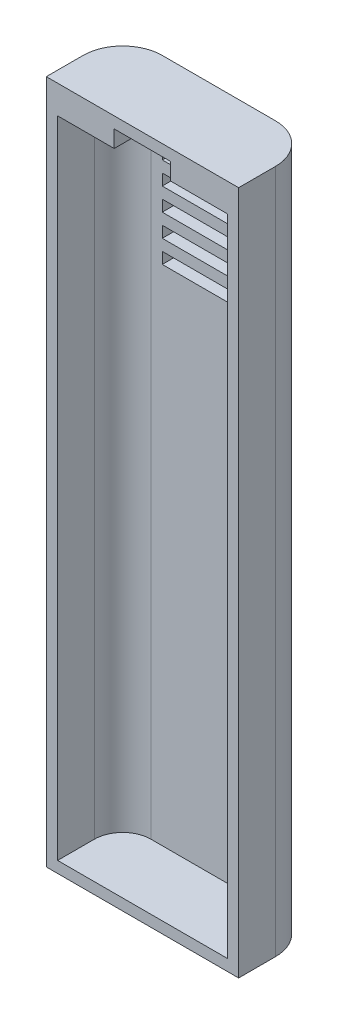
from build123d import *

# Parameters (mm, degrees)
ESBO_O1_W                = 34
ESBO_O1_H                = 121
RESSALTO_EXTRUS_O1_DEPTH = 6.5
RESSALTO_EXTRUS_O2_DEPTH = 62
RESSALTO_EXTRUS_O3_START = -59
RESSALTO_EXTRUS_O3_DEPTH = 59
RESSALTO_EXTRUS_O4_DEPTH = 2
RESSALTO_EXTRUS_O5_START = -2
RESSALTO_EXTRUS_O5_DEPTH = 2
ESBO_O8_W                = 16
ESBO_O8_H                = 2
CORTE_EXTRUS_O1_DEPTH    = 10


with BuildPart() as part:
    # Esboço1 → Ressalto-extrusão1 (new body)
    with BuildSketch(Plane.XY):
        with Locations((0, 1.5)):
            Rectangle(ESBO_O1_W, ESBO_O1_H)
        Polygon((15, -57), (-15, -57), (-15, 57), (-5, 57), (-5, 60), (5, 60), (5, 57), (15, 57), align=None, mode=Mode.SUBTRACT)
    extrude(amount=RESSALTO_EXTRUS_O1_DEPTH)

    # Esboço4 → Ressalto-extrusão2 (add)
    with BuildSketch(Plane(origin=(0, 0, 0), x_dir=(1, 0, 0), z_dir=(0, 1, 0))):
        with BuildLine():
            ThreePointArc((-10, 7), (-14.949747468, 4.949747468), (-17, 0))
            Line((-17, 0), (-15, 0))
            ThreePointArc((-15, 0), (-13.535533906, 3.535533906), (-10, 5))
            Line((-10, 5), (10, 5))
            ThreePointArc((10, 5), (13.535533906, 3.535533906), (15, 0))
            Line((15, 0), (17, 0))
            ThreePointArc((17, 0), (14.949747468, 4.949747468), (10, 7))
            Line((10, 7), (-10, 7))
        make_face()
    extrude(amount=RESSALTO_EXTRUS_O2_DEPTH)

    # Esboço4<3> → Ressalto-extrusão3 (add)
    with BuildSketch(Plane(origin=(0, 0, 0), x_dir=(1, 0, 0), z_dir=(0, 1, 0)).offset(RESSALTO_EXTRUS_O3_START)):
        with BuildLine():
            ThreePointArc((-10, 7), (-14.949747468, 4.949747468), (-17, 0))
            Line((-17, 0), (-15, 0))
            ThreePointArc((-15, 0), (-13.535533906, 3.535533906), (-10, 5))
            Line((-10, 5), (10, 5))
            ThreePointArc((10, 5), (13.535533906, 3.535533906), (15, 0))
            Line((15, 0), (17, 0))
            ThreePointArc((17, 0), (14.949747468, 4.949747468), (10, 7))
            Line((10, 7), (-10, 7))
        make_face()
    extrude(amount=RESSALTO_EXTRUS_O3_DEPTH)

    # Esboço6 → Ressalto-extrusão4 (add)
    with BuildSketch(Plane.XZ.offset(59)):
        with BuildLine():
            Line((-17, 6.5), (-17, 0))
            ThreePointArc((-17, 0), (-14.949747468, -4.949747468), (-10, -7))
            Line((-10, -7), (10, -7))
            ThreePointArc((10, -7), (14.949747468, -4.949747468), (17, 0))
            Line((17, 0), (17, 6.5))
            Line((17, 6.5), (-17, 6.5))
        make_face()
    extrude(amount=-RESSALTO_EXTRUS_O4_DEPTH)

    # Esboço7 → Ressalto-extrusão5 (add)
    with BuildSketch(Plane(origin=(0, 62, 0), x_dir=(1, 0, 0), z_dir=(0, 1, 0)).offset(RESSALTO_EXTRUS_O5_START)):
        with BuildLine():
            Line((17, -6.5), (17, 0))
            ThreePointArc((17, 0), (14.949747468, 4.949747468), (10, 7))
            Line((10, 7), (-10, 7))
            ThreePointArc((-10, 7), (-14.949747468, 4.949747468), (-17, 0))
            Line((-17, 0), (-17, -6.5))
            Line((-17, -6.5), (17, -6.5))
        make_face()
    extrude(amount=RESSALTO_EXTRUS_O5_DEPTH)

    # Esboço8 → Corte-extrusão1 (cut, symmetric)
    with BuildSketch(Plane(origin=(0, 0, -7), x_dir=(-1, 0, 0), z_dir=(0, 0, -1))):
        with Locations((0, 33)):
            Rectangle(ESBO_O8_W, ESBO_O8_H)
        with Locations((0, 37)):
            Rectangle(ESBO_O8_W, ESBO_O8_H)
        with Locations((0, 41)):
            Rectangle(ESBO_O8_W, ESBO_O8_H)
        with Locations((0, 45)):
            Rectangle(ESBO_O8_W, ESBO_O8_H)
        with Locations((0, 49)):
            Rectangle(ESBO_O8_W, ESBO_O8_H)
        with Locations((0, 53)):
            Rectangle(ESBO_O8_W, ESBO_O8_H)
    extrude(amount=CORTE_EXTRUS_O1_DEPTH, both=True, mode=Mode.SUBTRACT)


solid = part.part
